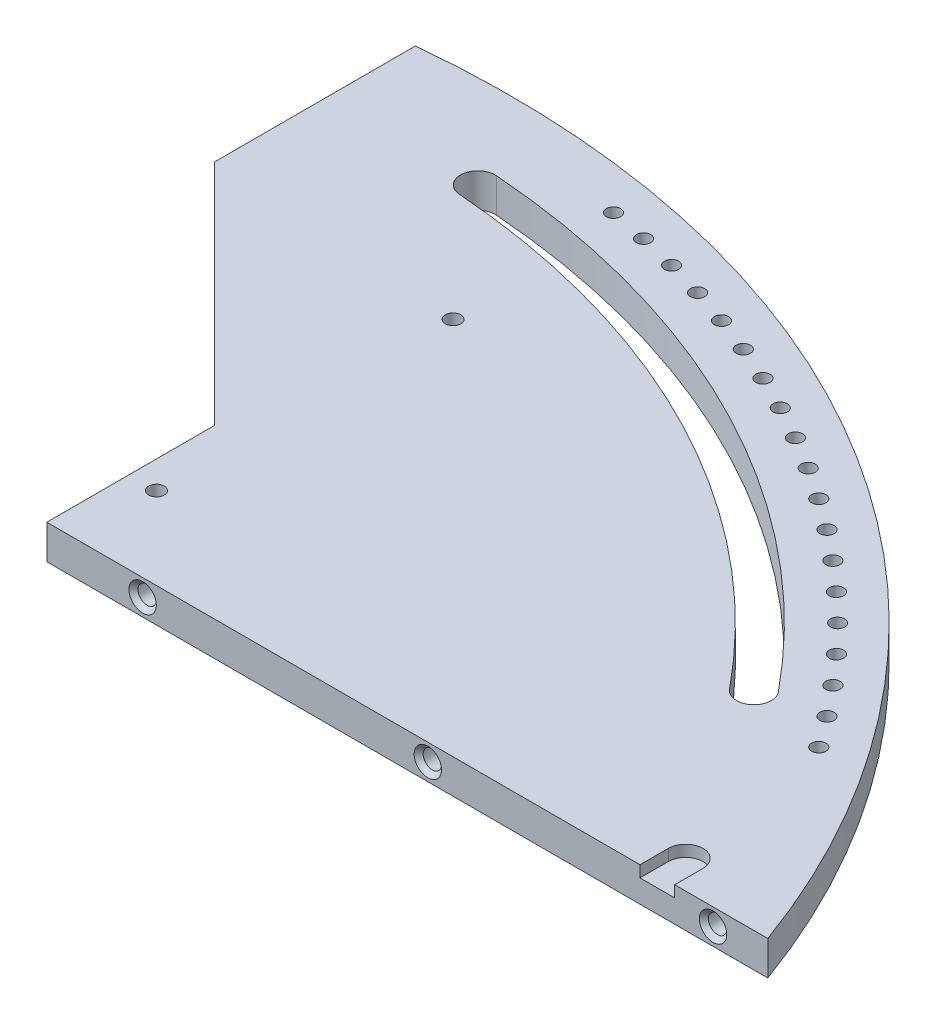
from build123d import *

# Parameters (mm, degrees)
BOSS_EXTRUDE1_DEPTH                                  = 4.7625
CUT_EXTRUDE2_DEPTH                                   = 349.730645664
CSK_FOR_M5_CROSS_RECESS_FLAT_HEAD_SCREW1_D           = 3.9624
CSK_FOR_M5_CROSS_RECESS_FLAT_HEAD_SCREW1_CSINK_D     = 6.35
CSK_FOR_M5_CROSS_RECESS_FLAT_HEAD_SCREW1_CSINK_ANGLE = 60
CIRPATTERN1_COUNT                                    = 19
CIRPATTERN1_ANGLE                                    = 45
CBORE_FOR_M5_CROSS_RECESS_PAN_HEAD_SCREW_D           = 4.3434
CBORE_FOR_M5_CROSS_RECESS_PAN_HEAD_SCREW_CBORE_D     = 7.9502
CBORE_FOR_M5_CROSS_RECESS_PAN_HEAD_SCREW_CBORE_DEPTH = 4.1656
CUT_EXTRUDE5_DEPTH                                   = 3.175
F_1_4_20_TAPPED_HOLE1_D                              = 5.1054
F_1_4_20_TAPPED_HOLE1_DEPTH                          = 19.05
F_1_4_20_TAPPED_HOLE1_CSINK_D                        = 7.62
F_1_4_20_TAPPED_HOLE1_CSINK_ANGLE                    = 90
F_1_4_20_TAPPED_HOLE1_TIP                            = 1.533816902


with BuildPart() as part:
    # Sketch1 → Boss-Extrude1 (new, symmetric)
    with BuildSketch(Plane(origin=(0, 0, 0), x_dir=(1, 0, 0), z_dir=(0, 1, 0))):
        with BuildLine():
            Line((38.1, 86.658308315), (238.76, 86.658308315))
            ThreePointArc((238.76, 86.658308315), (135.186201707, 215.036487295), (-25.4, 252.726809025))
            Line((-25.4, 252.726809025), (-25.4, 196.85))
            Line((-25.4, 196.85), (38.1, 133.35))
            Line((38.1, 133.35), (38.1, 86.658308315))
        make_face()
    extrude(amount=BOSS_EXTRUDE1_DEPTH, both=True)

    # Sketch2 → Cut-Extrude2 (cut, through all)
    with BuildSketch(Plane(origin=(0, 4.7625, 0), x_dir=(1, 0, 0), z_dir=(0, 1, 0))):
        with BuildLine():
            ThreePointArc((180.827242585, 147.531326552), (107.760674963, 207.006330595), (17.132342345, 232.74549796))
            ThreePointArc((17.132342345, 232.74549796), (11.965081824, 228.286801882), (16.423777903, 223.119541362))
            ThreePointArc((16.423777903, 223.119541362), (103.303877349, 198.444902033), (173.348536427, 141.429682659))
            ThreePointArc((173.348536427, 141.429682659), (180.138711452, 140.741151526), (180.827242585, 147.531326552))
        make_face()
    extrude(amount=-CUT_EXTRUDE2_DEPTH, mode=Mode.SUBTRACT)

    # CSK for M5 Cross Recess Flat Head Screw1 (through all)
    with Locations(Plane(origin=(0, -4.7625, 0), x_dir=(-1, 0, 0), z_dir=(0, -1, 0))):
        with Locations((-42.342371642, 240.135522494)):
            csk_for_m5_cross_recess_flat_head_screw1 = CounterSinkHole(CSK_FOR_M5_CROSS_RECESS_FLAT_HEAD_SCREW1_D / 2, CSK_FOR_M5_CROSS_RECESS_FLAT_HEAD_SCREW1_CSINK_D / 2, counter_sink_angle=CSK_FOR_M5_CROSS_RECESS_FLAT_HEAD_SCREW1_CSINK_ANGLE)

    # CirPattern1: CSK for M5 Cross Recess Flat Head Screw1 ×19 about axis
    cirpattern1_axis = Axis((0, 0, 0), (0, -1, 0))
    for i in range(1, CIRPATTERN1_COUNT):
        add(csk_for_m5_cross_recess_flat_head_screw1.rotate(cirpattern1_axis, i * CIRPATTERN1_ANGLE / (CIRPATTERN1_COUNT - 1)), mode=Mode.SUBTRACT)

    # CBORE for M5 Cross Recess Pan Head Screw2 (through all)
    with Locations(Plane(origin=(0, -4.7625, 0), x_dir=(-1, 0, 0), z_dir=(0, -1, 0))):
        with Locations((-45.72, 192.1002), (-45.72, 109.5502)):
            CounterBoreHole(CBORE_FOR_M5_CROSS_RECESS_PAN_HEAD_SCREW_D / 2, CBORE_FOR_M5_CROSS_RECESS_PAN_HEAD_SCREW_CBORE_D / 2, CBORE_FOR_M5_CROSS_RECESS_PAN_HEAD_SCREW_CBORE_DEPTH)

    # Sketch10 → Cut-Extrude5 (cut)
    with BuildSketch(Plane(origin=(0, 4.7625, 0), x_dir=(1, 0, 0), z_dir=(0, 1, 0))):
        with BuildLine():
            Line((203.2, 94.532308315), (203.2, 86.658308315))
            Line((203.2, 86.658308315), (212.852, 86.658308315))
            Line((212.852, 86.658308315), (212.852, 94.532308315))
            ThreePointArc((212.852, 94.532308315), (208.026, 99.358308315), (203.2, 94.532308315))
        make_face()
    extrude(amount=-CUT_EXTRUDE5_DEPTH, mode=Mode.SUBTRACT)

    # 1/4-20 Tapped Hole1
    with Locations(Plane.XY.offset(-86.658308315)):
        with Locations((64.77, 0), (144.145, 0), (223.52, 0)):
            CounterSinkHole(F_1_4_20_TAPPED_HOLE1_D / 2, F_1_4_20_TAPPED_HOLE1_CSINK_D / 2, depth=F_1_4_20_TAPPED_HOLE1_DEPTH, counter_sink_angle=F_1_4_20_TAPPED_HOLE1_CSINK_ANGLE)
            with Locations((0, 0, -(F_1_4_20_TAPPED_HOLE1_DEPTH + F_1_4_20_TAPPED_HOLE1_TIP / 2))):  # 118° drill point
                Cone(0, F_1_4_20_TAPPED_HOLE1_D / 2, F_1_4_20_TAPPED_HOLE1_TIP, mode=Mode.SUBTRACT)


solid = part.part
